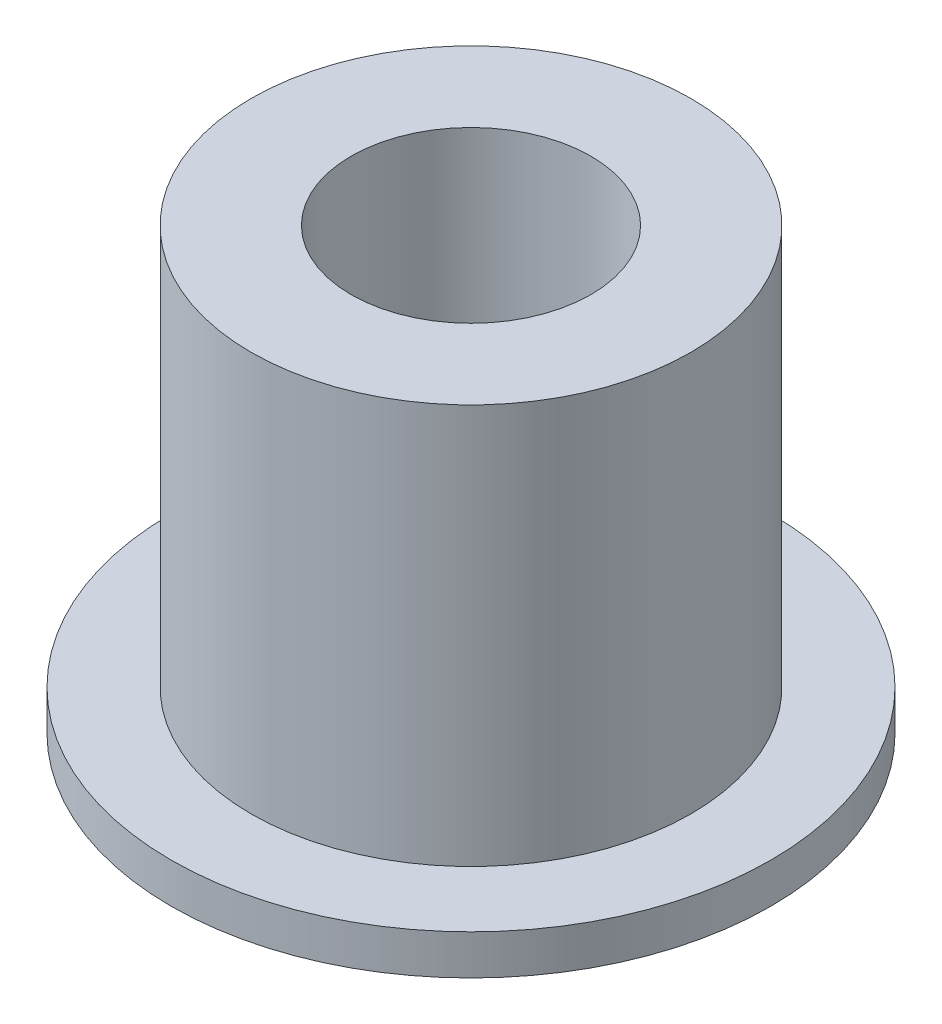
from build123d import *

# Parameters (mm, degrees)
SKETCH1_R           = 5.5
BOSS_EXTRUDE1_DEPTH = 5.5
SKETCH2_R           = 7.5
BOSS_EXTRUDE2_DEPTH = 1
SKETCH3_R           = 3
CUT_EXTRUDE1_DEPTH  = 16.28070679


with BuildPart() as part:
    # Sketch1 → Boss-Extrude1 (new, symmetric)
    with BuildSketch(Plane(origin=(0, 0, 0), x_dir=(1, 0, 0), z_dir=(0, 1, 0))):
        with Locations(Location((0, 0, 0), (0, 0, 270))):
            Circle(SKETCH1_R)
    extrude(amount=BOSS_EXTRUDE1_DEPTH, both=True)

    # Sketch2 → Boss-Extrude2 (add)
    with BuildSketch(Plane.XZ.offset(5.5)):
        with Locations(Location((0, 0, 0), (0, 0, 270))):
            Circle(SKETCH2_R)
    extrude(amount=-BOSS_EXTRUDE2_DEPTH)

    # Sketch3 → Cut-Extrude1 (cut, through all)
    with BuildSketch(Plane(origin=(0, 5.5, 0), x_dir=(1, 0, 0), z_dir=(0, 1, 0))):
        with Locations(Location((0, 0, 0), (0, 0, 270))):
            Circle(SKETCH3_R)
    extrude(amount=-CUT_EXTRUDE1_DEPTH, mode=Mode.SUBTRACT)


solid = part.part
